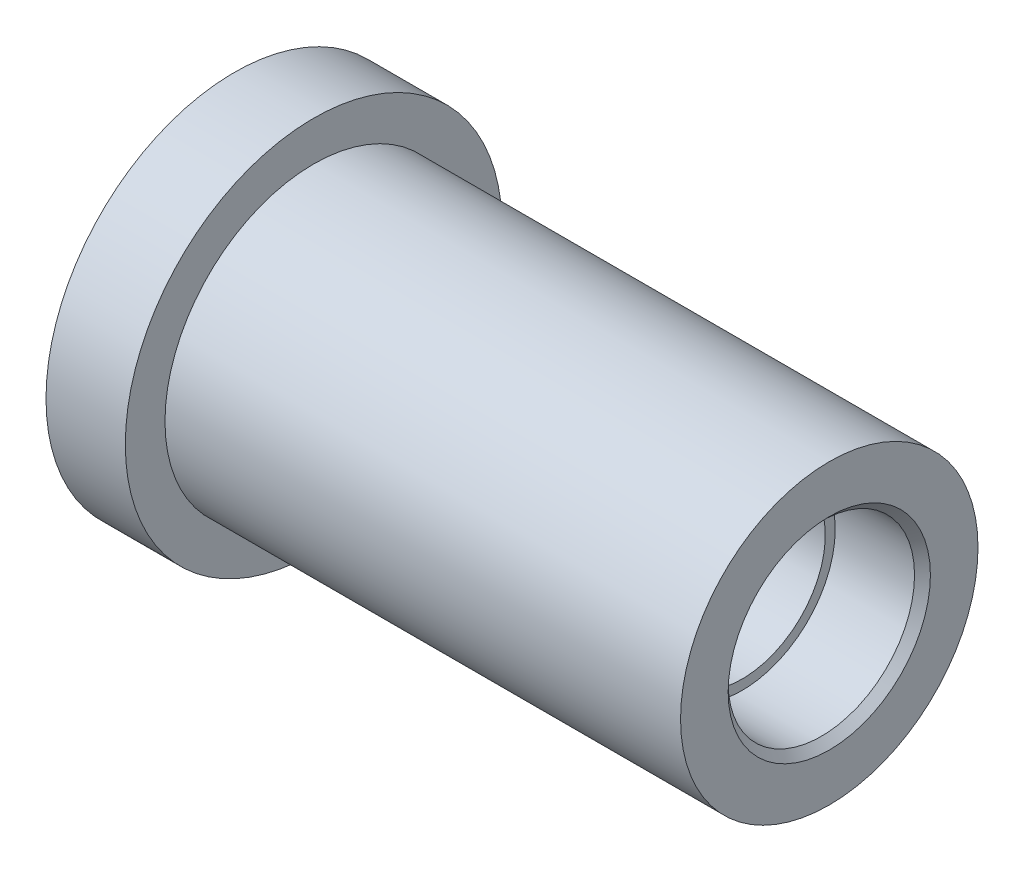
from build123d import *

# Parameters (mm, degrees)
PATTERN_CIRCULAR_1_COUNT = 6
CHAMFER_2_SIZE           = 1
CHAMFER_1_SIZE           = 2
SKETCH_5_W               = 130
SKETCH_5_H               = 10
SKETCH_6_R               = 27.5
SKETCH_6_R_2             = 23.5
CUT_EXTRUDE_1_DEPTH      = 5
CHAMFER_3_SIZE           = 1


with BuildPart() as part:
    # Эскиз1 → Повернуть1 (revolve)
    with BuildSketch(Plane.XY, mode=Mode.PRIVATE) as revolve_1_sk:
        Polygon((-75, 23.5), (-75, 47.5), (75, 47.5), (75, 23.5), (53, 23.5), (53, 21), (-53, 21), (-53, 23.5), align=None)
    revolve(revolve_1_sk.sketch.rotate(Axis((0, 0, 0), (1, 0, 0)), 90), axis=Axis((0, 0, 0), (1, 0, 0)))

    # Эскиз3 → Отверстие обработанное метчиком M61 (revolve, cut)
    with BuildSketch(Plane(origin=(-75, 37.5, 0), x_dir=(0, 0, 1), z_dir=(0, 1, 0))):
        Polygon((0, 0), (0, 17), (2.5, 15.497848452), (2.5, 0), align=None)
    hole_wizard_m61 = revolve(axis=Axis((-81.35, 37.5, 0), (1, 0, 0)), mode=Mode.SUBTRACT)

    # Круговой массив1: Отверстие обработанное метчиком M61 ×6 about axis
    pattern_circular_1_axis = Axis((0, 0, 0), (1, 0, 0))
    for i in range(1, PATTERN_CIRCULAR_1_COUNT):
        add(hole_wizard_m61.rotate(pattern_circular_1_axis, i * 360 / PATTERN_CIRCULAR_1_COUNT), mode=Mode.SUBTRACT)

    # Фаска2
    chamfer_2_edges = [part.edges().sort_by_distance(p)[0] for p in [
        (-75, 37.5, -2.5),
        (-75, 16.584936491, -33.725952642),
        (-75, -20.915063509, -31.225952642),
        (-75, -37.5, 2.5),
        (-75, -16.584936491, 33.725952642),
        (-75, 20.915063509, 31.225952642),
    ]]
    chamfer(chamfer_2_edges, length=CHAMFER_2_SIZE)

    # Фаска1
    chamfer_1_edges = [part.edges().sort_by_distance(p)[0] for p in [
        (75, 0, -23.5),
    ]]
    chamfer(chamfer_1_edges, length=CHAMFER_1_SIZE)

    # Эскиз5 → Вырез-Повернуть1 (revolve, cut)
    with BuildSketch(Plane.XY, mode=Mode.PRIVATE) as cut_revolve_1_sk:
        with Locations((10, 42.5)):
            Rectangle(SKETCH_5_W, SKETCH_5_H)
    revolve(cut_revolve_1_sk.sketch.rotate(Axis((-75, 0, 0), (1, 0, 0)), 90), axis=Axis((-75, 0, 0), (1, 0, 0)), mode=Mode.SUBTRACT)

    # Эскиз6 → Вырез-Вытянуть1 (cut)
    with BuildSketch(Plane.ZY.offset(75)):
        Circle(SKETCH_6_R)
        Circle(SKETCH_6_R_2, mode=Mode.SUBTRACT)
    extrude(amount=-CUT_EXTRUDE_1_DEPTH, mode=Mode.SUBTRACT)

    # Фаска3
    chamfer_3_edges = [part.edges().sort_by_distance(p)[0] for p in [
        (-70, 0, -23.5),
        (-75, 0, -27.5),
    ]]
    chamfer(chamfer_3_edges, length=CHAMFER_3_SIZE)


solid = part.part
